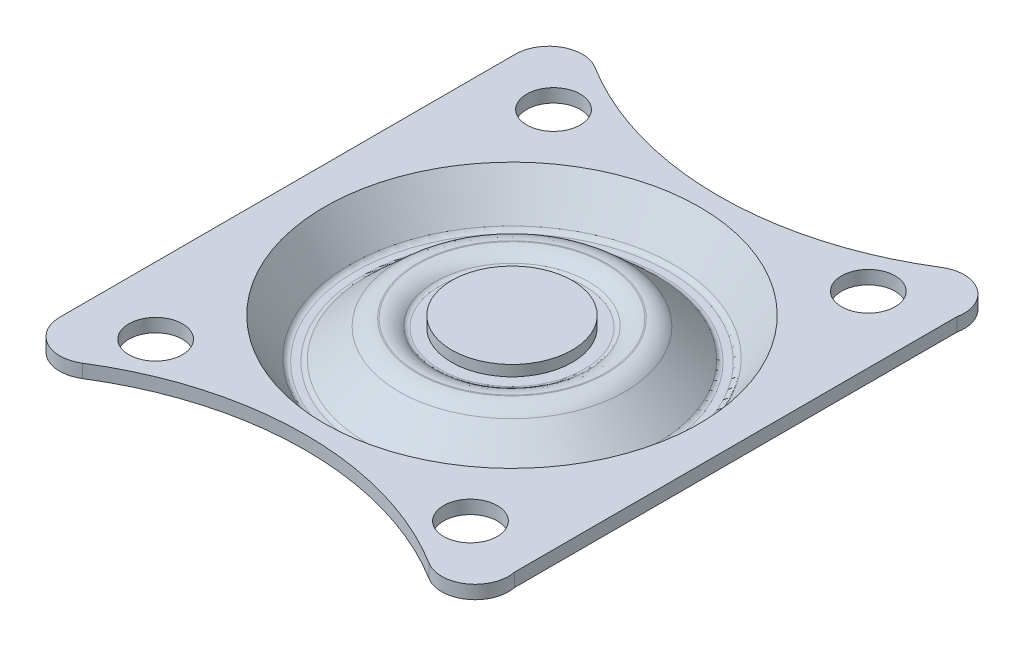
from build123d import *

# Parameters (mm, degrees)
CROQUIS1_R     = 2
EXTRUIR1_DEPTH = 1
CROQUIS4_R     = 14
EXTRUIR3_DEPTH = 26.725716705
REDONDEO1_R    = 2
REDONDEO2_R    = 0.5
REDONDEO3_R    = 2
CROQUIS2_R     = 4
EXTRUIR5_DEPTH = 27.015620308
CROQUIS5_R     = 4.5
EXTRUIR6_DEPTH = 6
CROQUIS6_R     = 5
EXTRUIR7_DEPTH = 1
REDONDEO7_R    = 0.5
MATRIZC3_COUNT = 16


with BuildPart() as part:
    # Croquis1 → Extruir1 (new body)
    with BuildSketch(Plane(origin=(0, 0, 0), x_dir=(1, 0, 0), z_dir=(0, 1, 0))):
        with BuildLine():
            Line((-16.75, -17), (-16.75, 17))
            ThreePointArc((-16.75, 17), (-15.463701005, 19.185618876), (-12.928456103, 19.12215026))
            ThreePointArc((-12.928456103, 19.12215026), (0, 15.425705684), (12.928456103, 19.12215026))
            ThreePointArc((12.928456103, 19.12215026), (15.677229293, 19.052563408), (16.699489743, 16.5))
            Line((16.699489743, 16.5), (16.699489743, -16.5))
            ThreePointArc((16.699489743, -16.5), (15.677229293, -19.052563408), (12.928456103, -19.12215026))
            ThreePointArc((12.928456103, -19.12215026), (0, -15.425705684), (-12.928456103, -19.12215026))
            ThreePointArc((-12.928456103, -19.12215026), (-15.463701005, -19.185618876), (-16.75, -17))
        make_face()
        with Locations((-11.75, -14.85)):
            Circle(CROQUIS1_R, mode=Mode.SUBTRACT)
        with Locations((-11.75, 14.85)):
            Circle(CROQUIS1_R, mode=Mode.SUBTRACT)
        with Locations((11.75, -14.85)):
            Circle(CROQUIS1_R, mode=Mode.SUBTRACT)
        with Locations((11.75, 14.85)):
            Circle(CROQUIS1_R, mode=Mode.SUBTRACT)
    extrude(amount=EXTRUIR1_DEPTH)

    # Croquis4 → Extruir3 (cut, through all)
    with BuildSketch(Plane(origin=(0, 1, 0), x_dir=(1, 0, 0), z_dir=(0, 1, 0))):
        Circle(CROQUIS4_R)
    extrude(amount=-EXTRUIR3_DEPTH, mode=Mode.SUBTRACT)

    # Croquis3 → Revolución1 (revolve)
    with BuildSketch(Plane.XY):
        Polygon((-14.527696455, 0), (-12.476697882, -3), (-10.562471246, -3), (-7.481645354, -0.2), (-6.670899824, -0.2), (-6.471898398, -0.8), (0, -0.8), (0, 0.2), (-5.75, 0.2), (-5.949001427, 0.8), (-7.868175534, 0.8), (-10.949001427, -2), (-11.949001427, -2), (-12.949001427, -0.537297861), (-14, 1), (-14, 0), align=None)
    revolve(axis=Axis((0, 0.2, 0), (0, 1, 0)))

    # Redondeo1
    redondeo1_edges = [part.edges().sort_by_distance(p)[0] for p in [
        (10.562471246, -3, 0),
        (12.476697882, -3, 0),
    ]]
    fillet(redondeo1_edges, radius=REDONDEO1_R)

    # Redondeo2
    redondeo2_edges = [part.edges().sort_by_distance(p)[0] for p in [
        (11.949001427, -2, 0),
        (5.75, 0.2, 0),
        (10.949001427, -2, 0),
    ]]
    fillet(redondeo2_edges, radius=REDONDEO2_R)

    # Redondeo3
    redondeo3_edges = [part.edges().sort_by_distance(p)[0] for p in [
        (5.949001427, 0.8, 0),
        (7.868175534, 0.8, 0),
    ]]
    fillet(redondeo3_edges, radius=REDONDEO3_R)

    # Croquis2 → Extruir5 (cut, through all)
    with BuildSketch(Plane(origin=(0, 1, 0), x_dir=(1, 0, 0), z_dir=(0, 1, 0))):
        Circle(CROQUIS2_R)
    extrude(amount=-EXTRUIR5_DEPTH, mode=Mode.SUBTRACT)

    # Croquis5 → Extruir6 (add)
    with BuildSketch(Plane(origin=(0, 1, 0), x_dir=(1, 0, 0), z_dir=(0, 1, 0))):
        Circle(CROQUIS5_R)
    extrude(amount=-EXTRUIR6_DEPTH)

    # Croquis6 → Extruir7 (add)
    with BuildSketch(Plane.XZ.offset(5)):
        Circle(CROQUIS6_R)
    extrude(amount=EXTRUIR7_DEPTH)

    # Redondeo7
    redondeo7_edges = [part.edges().sort_by_distance(p)[0] for p in [
        (-5, -6, 0),
    ]]
    fillet(redondeo7_edges, radius=REDONDEO7_R)


with BuildPart() as body_2:
    # Croquis7 → Revolución2 (revolve)
    with BuildSketch(Plane.XY):
        with BuildLine():
            Line((-7.580095881, -0.441845671), (-7.580095881, -3.441845671))
            ThreePointArc((-7.580095881, -3.441845671), (-9.080095881, -1.941845671), (-7.580095881, -0.441845671))
        make_face()
    revolve(axis=Axis((-7.580095881, -0.441845671, 0), (0, -1, 0)))


with BuildPart() as matrizc3_1:
    # MatrizC3: pattern copy
    add(body_2.part.rotate(Axis((0, -6.35, 0), (0, 1, 0)), 1 * 360 / MATRIZC3_COUNT))


with BuildPart() as matrizc3_2:
    # MatrizC3: pattern copy
    add(body_2.part.rotate(Axis((0, -6.35, 0), (0, 1, 0)), 2 * 360 / MATRIZC3_COUNT))


with BuildPart() as matrizc3_3:
    # MatrizC3: pattern copy
    add(body_2.part.rotate(Axis((0, -6.35, 0), (0, 1, 0)), 3 * 360 / MATRIZC3_COUNT))


with BuildPart() as matrizc3_4:
    # MatrizC3: pattern copy
    add(body_2.part.rotate(Axis((0, -6.35, 0), (0, 1, 0)), 4 * 360 / MATRIZC3_COUNT))


with BuildPart() as matrizc3_5:
    # MatrizC3: pattern copy
    add(body_2.part.rotate(Axis((0, -6.35, 0), (0, 1, 0)), 5 * 360 / MATRIZC3_COUNT))


with BuildPart() as matrizc3_6:
    # MatrizC3: pattern copy
    add(body_2.part.rotate(Axis((0, -6.35, 0), (0, 1, 0)), 6 * 360 / MATRIZC3_COUNT))


with BuildPart() as matrizc3_7:
    # MatrizC3: pattern copy
    add(body_2.part.rotate(Axis((0, -6.35, 0), (0, 1, 0)), 7 * 360 / MATRIZC3_COUNT))


with BuildPart() as matrizc3_8:
    # MatrizC3: pattern copy
    add(body_2.part.rotate(Axis((0, -6.35, 0), (0, 1, 0)), 8 * 360 / MATRIZC3_COUNT))


with BuildPart() as matrizc3_9:
    # MatrizC3: pattern copy
    add(body_2.part.rotate(Axis((0, -6.35, 0), (0, 1, 0)), 9 * 360 / MATRIZC3_COUNT))


with BuildPart() as matrizc3_10:
    # MatrizC3: pattern copy
    add(body_2.part.rotate(Axis((0, -6.35, 0), (0, 1, 0)), 10 * 360 / MATRIZC3_COUNT))


with BuildPart() as matrizc3_11:
    # MatrizC3: pattern copy
    add(body_2.part.rotate(Axis((0, -6.35, 0), (0, 1, 0)), 11 * 360 / MATRIZC3_COUNT))


with BuildPart() as matrizc3_12:
    # MatrizC3: pattern copy
    add(body_2.part.rotate(Axis((0, -6.35, 0), (0, 1, 0)), 12 * 360 / MATRIZC3_COUNT))


with BuildPart() as matrizc3_13:
    # MatrizC3: pattern copy
    add(body_2.part.rotate(Axis((0, -6.35, 0), (0, 1, 0)), 13 * 360 / MATRIZC3_COUNT))


with BuildPart() as matrizc3_14:
    # MatrizC3: pattern copy
    add(body_2.part.rotate(Axis((0, -6.35, 0), (0, 1, 0)), 14 * 360 / MATRIZC3_COUNT))


with BuildPart() as matrizc3_15:
    # MatrizC3: pattern copy
    add(body_2.part.rotate(Axis((0, -6.35, 0), (0, 1, 0)), 15 * 360 / MATRIZC3_COUNT))


solid = Compound([part.part, body_2.part, matrizc3_1.part, matrizc3_2.part, matrizc3_3.part, matrizc3_4.part, matrizc3_5.part, matrizc3_6.part, matrizc3_7.part, matrizc3_8.part, matrizc3_9.part, matrizc3_10.part, matrizc3_11.part, matrizc3_12.part, matrizc3_13.part, matrizc3_14.part, matrizc3_15.part])
